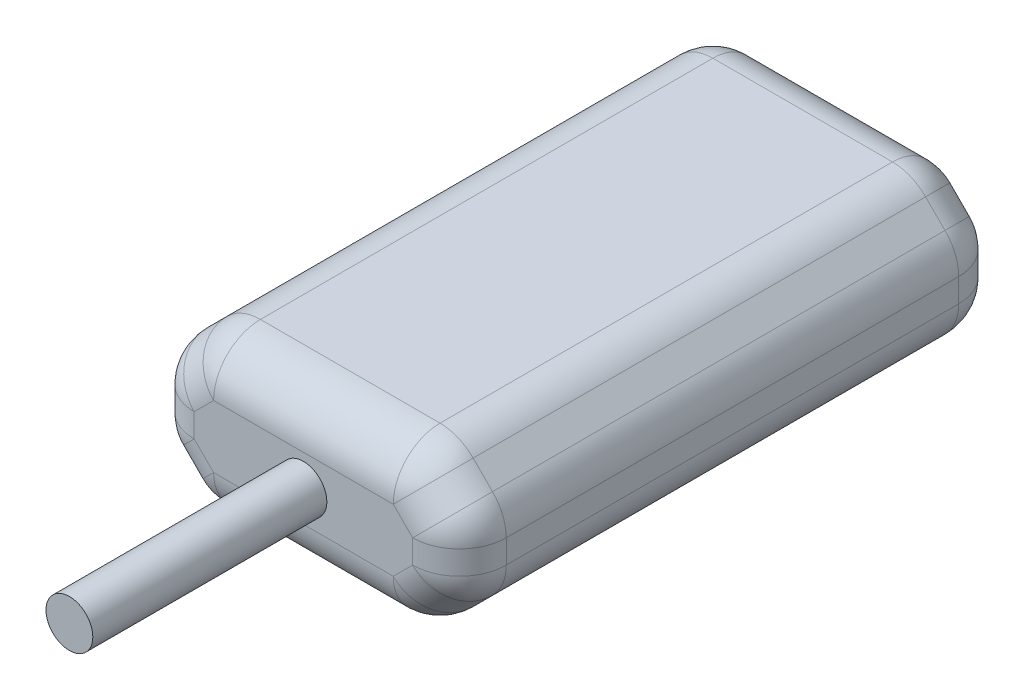
from build123d import *

# Parameters (mm, degrees)
SKETCH_1_W      = 20
SKETCH_1_H      = 10
EXTRUDE_1_DEPTH = 35
CHAMFER_2_SIZE  = 3
FILLET_1_R      = 3
SKETCH_2_R      = 1.5
EXTRUDE_2_DEPTH = 15


with BuildPart() as part:
    # 草图1 → 凸台-拉伸1 (new body)
    with BuildSketch(Plane.XY):
        with Locations((10, 5)):
            Rectangle(SKETCH_1_W, SKETCH_1_H)
    extrude(amount=EXTRUDE_1_DEPTH)

    # 倒角2
    chamfer_2_edges = [part.edges().sort_by_distance(p)[0] for p in [
        (0, 0, 17.5),
        (0, 10, 17.5),
        (20, 10, 17.5),
        (20, 0, 17.5),
    ]]
    chamfer(chamfer_2_edges, length=CHAMFER_2_SIZE)

    # 圆角1
    fillet_1_edges = [part.edges().sort_by_distance(p)[0] for p in [
        (20, 5, 0),
        (20, 5, 35),
        (20, 7, 17.5),
        (20, 3, 17.5),
        (10, 0, 0),
        (0, 5, 0),
        (10, 10, 0),
        (18.5, 8.5, 0),
        (1.5, 8.5, 0),
        (1.5, 1.5, 0),
        (18.5, 1.5, 0),
        (10, 0, 35),
        (3, 0, 17.5),
        (17, 0, 17.5),
        (10, 10, 35),
        (0, 5, 35),
        (18.5, 8.5, 35),
        (1.5, 8.5, 35),
        (1.5, 1.5, 35),
        (18.5, 1.5, 35),
        (0, 7, 17.5),
        (0, 3, 17.5),
        (17, 10, 17.5),
        (3, 10, 17.5),
    ]]
    fillet(fillet_1_edges, radius=FILLET_1_R)

    # 草图2 → 凸台-拉伸2 (add)
    with BuildSketch(Plane.XY.offset(35)):
        with Locations(Location((10, 5, 0), (0, 0, 180))):
            Circle(SKETCH_2_R)
    extrude(amount=EXTRUDE_2_DEPTH)


solid = part.part
